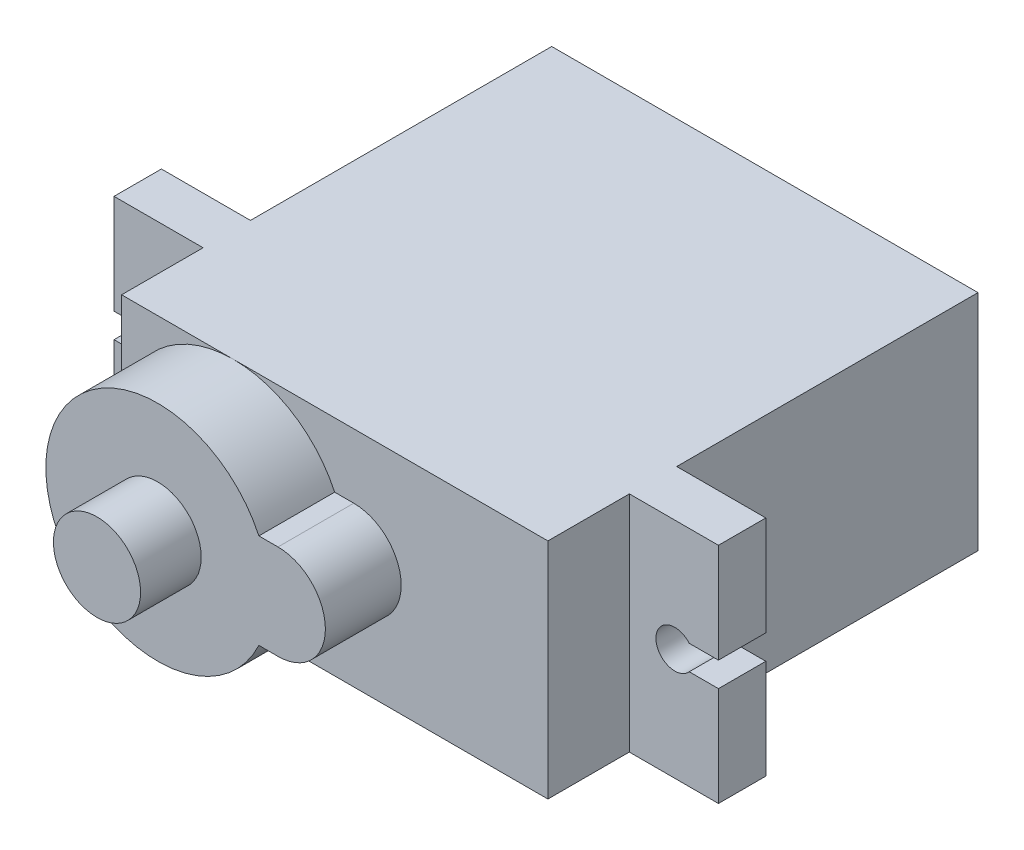
from build123d import *

# Parameters (mm, degrees)
CROQUIS1_W              = 22.5
CROQUIS1_H              = 11.8
SALIENTE_EXTRUIR1_DEPTH = 22.7
SALIENTE_EXTRUIR2_DEPTH = 2.5
SALIENTE_EXTRUIR3_DEPTH = 4
CROQUIS4_R              = 2.3
SALIENTE_EXTRUIR4_DEPTH = 3.2
CROQUIS5_W              = 1.844144091
CROQUIS5_H              = 3.6
CORTAR_EXTRUIR1_DEPTH   = 1.6


with BuildPart() as part:
    # Croquis1 → Saliente-Extruir1 (new body)
    with BuildSketch(Plane.XY):
        Rectangle(CROQUIS1_W, CROQUIS1_H)
    extrude(amount=SALIENTE_EXTRUIR1_DEPTH)

    # Croquis2 → Saliente-Extruir2 (add)
    with BuildSketch(Plane.XY.offset(15.9)):
        with BuildLine():
            Line((11.25, 5.9), (15.95, 5.9))
            Line((15.95, 5.9), (15.95, 0.647985587))
            Line((15.95, 0.647985587), (14.411652597, 0.647985587))
            ThreePointArc((14.411652597, 0.647985587), (12.650003513, 0.00265078), (14.408206572, -0.652014413))
            Line((14.408206572, -0.652014413), (15.95, -0.652014413))
            Line((15.95, -0.652014413), (15.95, -5.904028826))
            Line((15.95, -5.904028826), (11.25, -5.904028826))
            Line((11.25, -5.904028826), (11.25, 5.9))
        make_face()
        with BuildLine():
            Line((-11.25, 5.9), (-15.95, 5.9))
            Line((-15.95, 5.9), (-15.95, 0.647985587))
            Line((-15.95, 0.647985587), (-14.411652597, 0.647985587))
            ThreePointArc((-14.411652597, 0.647985587), (-12.650003513, 0.00265078), (-14.408206572, -0.652014413))
            Line((-14.408206572, -0.652014413), (-15.95, -0.652014413))
            Line((-15.95, -0.652014413), (-15.95, -5.904028826))
            Line((-15.95, -5.904028826), (-11.25, -5.904028826))
            Line((-11.25, -5.904028826), (-11.25, 5.9))
        make_face()
    extrude(amount=SALIENTE_EXTRUIR2_DEPTH)

    # Croquis3 → Saliente-Extruir3 (add)
    with BuildSketch(Plane.XY.offset(22.7)):
        with BuildLine():
            Line((1.003159638, -2.50231492), (-0.006927846, -2.50231492))
            ThreePointArc((-0.006927846, -2.50231492), (-11.24999987, 0.001237918), (-0.005878262, 2.500072568))
            Line((-0.005878262, 2.500072568), (1.003159638, 2.500072568))
            ThreePointArc((1.003159638, 2.500072568), (3.504353382, -0.001121176), (1.003159638, -2.50231492))
        make_face()
    extrude(amount=SALIENTE_EXTRUIR3_DEPTH)

    # Croquis4 → Saliente-Extruir4 (add)
    with BuildSketch(Plane.XY.offset(26.7)):
        with Locations((-5.35, 0)):
            Circle(CROQUIS4_R)
    extrude(amount=SALIENTE_EXTRUIR4_DEPTH)

    # Croquis5 → Cortar-Extruir1 (cut, symmetric)
    with BuildSketch(Plane.ZY.offset(11.25)):
        with Locations((5.422072046, -0.7)):
            Rectangle(CROQUIS5_W, CROQUIS5_H)
    extrude(amount=CORTAR_EXTRUIR1_DEPTH, both=True, mode=Mode.SUBTRACT)


solid = part.part
